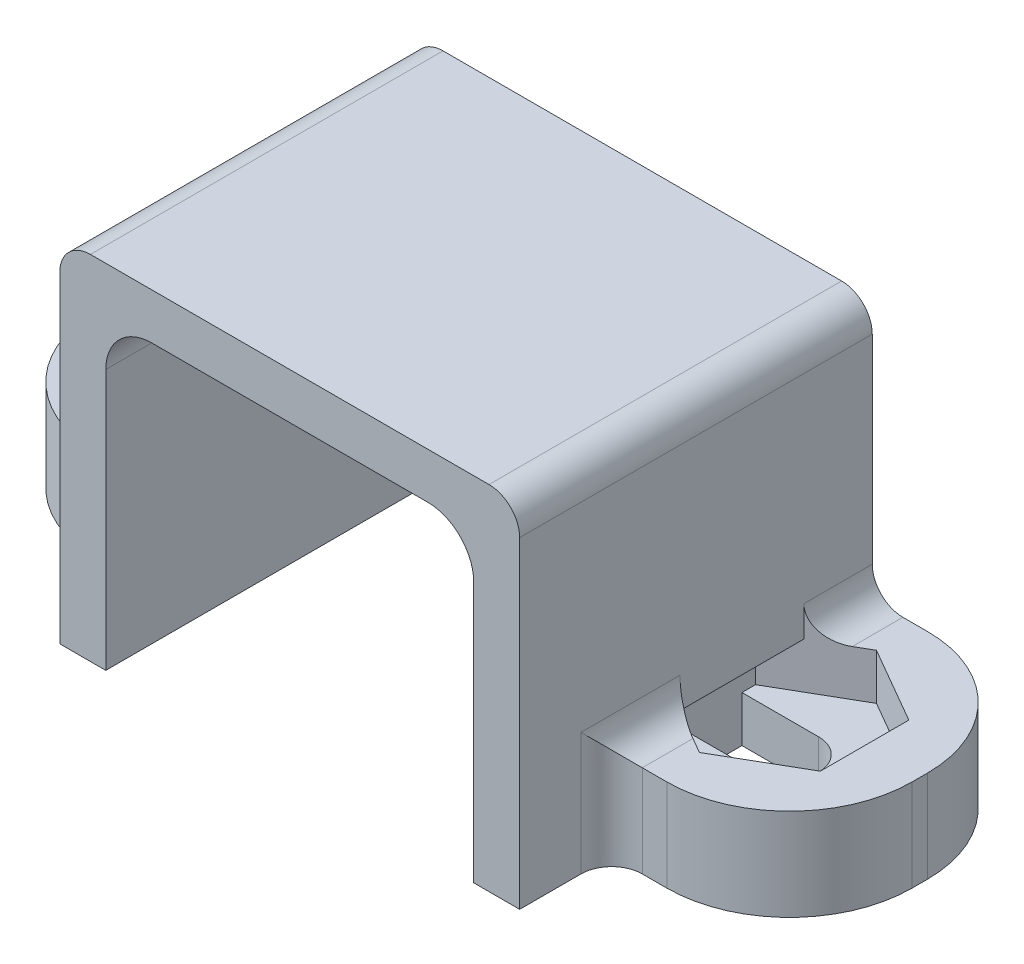
from build123d import *

# Parameters (mm, degrees)
BOSS_EXTRUDE1_DEPTH    = 17
SPLIT2_SURFACE_1_BACK  = 26.421
SPLIT2_SURFACE_1_DEPTH = 52.842
SPLIT2_SURFACE_2_BACK  = 26.421
SPLIT2_SURFACE_2_DEPTH = 52.842
SKETCH13_W             = 5.8
SKETCH13_H             = 8.5
BOSS_EXTRUDE10_DEPTH   = 3
FILLET7_R              = 4
SPLIT3_SURFACE_3_BACK  = 34.598
SPLIT3_SURFACE_3_DEPTH = 69.196
SPLIT3_SURFACE_4_BACK  = 34.598
SPLIT3_SURFACE_4_DEPTH = 69.196
CUT_EXTRUDE1_DEPTH     = 1.5
CUT_EXTRUDE2_DEPTH     = 29.664263465
FILLET_1_R             = 1
FILLET_2_R             = 1
FILLET_3_R             = 1.5
CUT_EXTRUDE_START      = 11.5
SKETCH_1_W             = 75.774826167
SKETCH_1_H             = 36.419346407
CUT_EXTRUDE_1_DEPTH    = 10


with BuildPart() as part:
    # Sketch1 → Boss-Extrude1 (new body)
    with BuildSketch(Plane.XY):
        Polygon((0, 0), (1.5, 0), (1.5, 10), (13.5, 10), (13.5, 0), (15, 0), (15, 11.5), (0, 11.5), (0, 10), align=None)
    extrude(amount=BOSS_EXTRUDE1_DEPTH)


with BuildPart() as body_2:
    # Split2: the piece behind the surface
    add(part.part)
    # Split2 surface: a surface, the sketch's curves swept straight by 52.842 mm
    with BuildLine(Plane.XZ.offset(-SPLIT2_SURFACE_1_BACK), mode=Mode.PRIVATE) as split2_surface_1_path:
        Line((15, 8), (0, 8))
    split2_surface_1 = Shell.extrude(split2_surface_1_path.wire(), (0 * SPLIT2_SURFACE_1_DEPTH, -1 * SPLIT2_SURFACE_1_DEPTH, 0 * SPLIT2_SURFACE_1_DEPTH))
    split(bisect_by=split2_surface_1, keep=Keep.BOTTOM)


with BuildPart() as part_1:
    add(part.part)

    # Split2: split by a surface, the side it looks to stays
    # Split2 surface: a surface, the sketch's curves swept straight by 52.842 mm
    with BuildLine(Plane.XZ.offset(-SPLIT2_SURFACE_2_BACK), mode=Mode.PRIVATE) as split2_surface_2_path:
        Line((15, 8), (0, 8))
    split2_surface_2 = Shell.extrude(split2_surface_2_path.wire(), (0 * SPLIT2_SURFACE_2_DEPTH, -1 * SPLIT2_SURFACE_2_DEPTH, 0 * SPLIT2_SURFACE_2_DEPTH))
    split(bisect_by=split2_surface_2, keep=Keep.TOP)


with BuildPart() as body_2_1:
    add(body_2.part)

    # Combine2: union part
    add(part_1.part)

    # Sketch13 → Boss-Extrude10 (add)
    with BuildSketch(Plane.XZ):
        with Locations((-2.9, 4.25)):
            Rectangle(SKETCH13_W, SKETCH13_H)
        with Locations((17.9, 4.25)):
            Rectangle(SKETCH13_W, SKETCH13_H)
    extrude(amount=-BOSS_EXTRUDE10_DEPTH)

    # Fillet7
    fillet7_edges = [body_2_1.edges().sort_by_distance(p)[0] for p in [
        (20.8, 1.5, 8.5),
        (20.8, 1.5, 0),
        (-5.8, 1.5, 0),
        (-5.8, 1.5, 8.5),
    ]]
    fillet(fillet7_edges, radius=FILLET7_R)


with BuildPart() as body_2_2:
    # Split3: the piece behind the surface
    add(body_2_1.part)
    # Split3 surface: a surface, the sketch's curves swept straight by 69.196 mm
    with BuildLine(Plane.ZY.offset(-SPLIT3_SURFACE_3_BACK), mode=Mode.PRIVATE) as split3_surface_3_path:
        Line((0, 3), (17, 3))
    split3_surface_3 = Shell.extrude(split3_surface_3_path.wire(), (-1 * SPLIT3_SURFACE_3_DEPTH, 0 * SPLIT3_SURFACE_3_DEPTH, 0 * SPLIT3_SURFACE_3_DEPTH))
    split(bisect_by=split3_surface_3, keep=Keep.BOTTOM)

    # Sketch16 → Cut-Extrude1 (cut)
    with BuildSketch(Plane(origin=(0, 3, 0), x_dir=(1, 0, 0), z_dir=(0, 1, 0))):
        Polygon((-4, -2.806624327), (-4, -5.693375673), (-1.5, -7.136751346), (1, -5.693375673), (1, -2.806624327), (-1.5, -1.363248654), align=None)
        Polygon((14, -5.693375673), (14, -2.806624327), (16.5, -1.363248654), (19, -2.806624327), (19, -5.693375673), (16.5, -7.136751346), align=None)
    extrude(amount=-CUT_EXTRUDE1_DEPTH, mode=Mode.SUBTRACT)

    # Sketch17 → Cut-Extrude2 (cut, through all)
    with BuildSketch(Plane(origin=(0, 1.5, 0), x_dir=(1, 0, 0), z_dir=(0, 1, 0))):
        with BuildLine():
            Line((16.5, -5.25), (14, -5.25))
            Line((14, -5.25), (14, -3.25))
            Line((14, -3.25), (16.5, -3.25))
            ThreePointArc((16.5, -3.25), (17.5, -4.25), (16.5, -5.25))
        make_face()
        with BuildLine():
            Line((1, -3.25), (1, -5.25))
            Line((1, -5.25), (-1.5, -5.25))
            ThreePointArc((-1.5, -5.25), (-2.5, -4.25), (-1.5, -3.25))
            Line((-1.5, -3.25), (1, -3.25))
        make_face()
    extrude(amount=-CUT_EXTRUDE2_DEPTH, mode=Mode.SUBTRACT)


with BuildPart() as body_2_3:
    add(body_2_1.part)

    # Split3: split by a surface, the side it looks to stays
    # Split3 surface: a surface, the sketch's curves swept straight by 69.196 mm
    with BuildLine(Plane.ZY.offset(-SPLIT3_SURFACE_4_BACK), mode=Mode.PRIVATE) as split3_surface_4_path:
        Line((0, 3), (17, 3))
    split3_surface_4 = Shell.extrude(split3_surface_4_path.wire(), (-1 * SPLIT3_SURFACE_4_DEPTH, 0 * SPLIT3_SURFACE_4_DEPTH, 0 * SPLIT3_SURFACE_4_DEPTH))
    split(bisect_by=split3_surface_4, keep=Keep.TOP)

    # Combine3: union body 2 2
    add(body_2_2.part)

    # Скругление1
    fillet_1_edges = [body_2_3.edges().sort_by_distance(p)[0] for p in [
        (0, 3, 1.114637029),
        (0, 3, 7.385362971),
        (15, 3, 7.385362971),
        (15, 3, 1.114637029),
    ]]
    fillet(fillet_1_edges, radius=FILLET_1_R)

    # Скругление2
    fillet_2_edges = [body_2_3.edges().sort_by_distance(p)[0] for p in [
        (0, 2, 8.5),
        (15, 2, 8.5),
        (0, 11.5, 8.5),
        (15, 11.5, 8.5),
    ]]
    fillet(fillet_2_edges, radius=FILLET_2_R)

    # Скругление3
    fillet_3_edges = [body_2_3.edges().sort_by_distance(p)[0] for p in [
        (13.5, 10, 8.5),
        (1.5, 10, 8.5),
    ]]
    fillet(fillet_3_edges, radius=FILLET_3_R)

    # Эскиз1 → Вырез-Вытянуть1 (cut)
    with BuildSketch(Plane.XY.offset(CUT_EXTRUDE_START)):
        with Locations((-10.82260141, 13.923178903)):
            Rectangle(SKETCH_1_W, SKETCH_1_H)
    extrude(amount=CUT_EXTRUDE_1_DEPTH, mode=Mode.SUBTRACT)


solid = body_2_3.part
